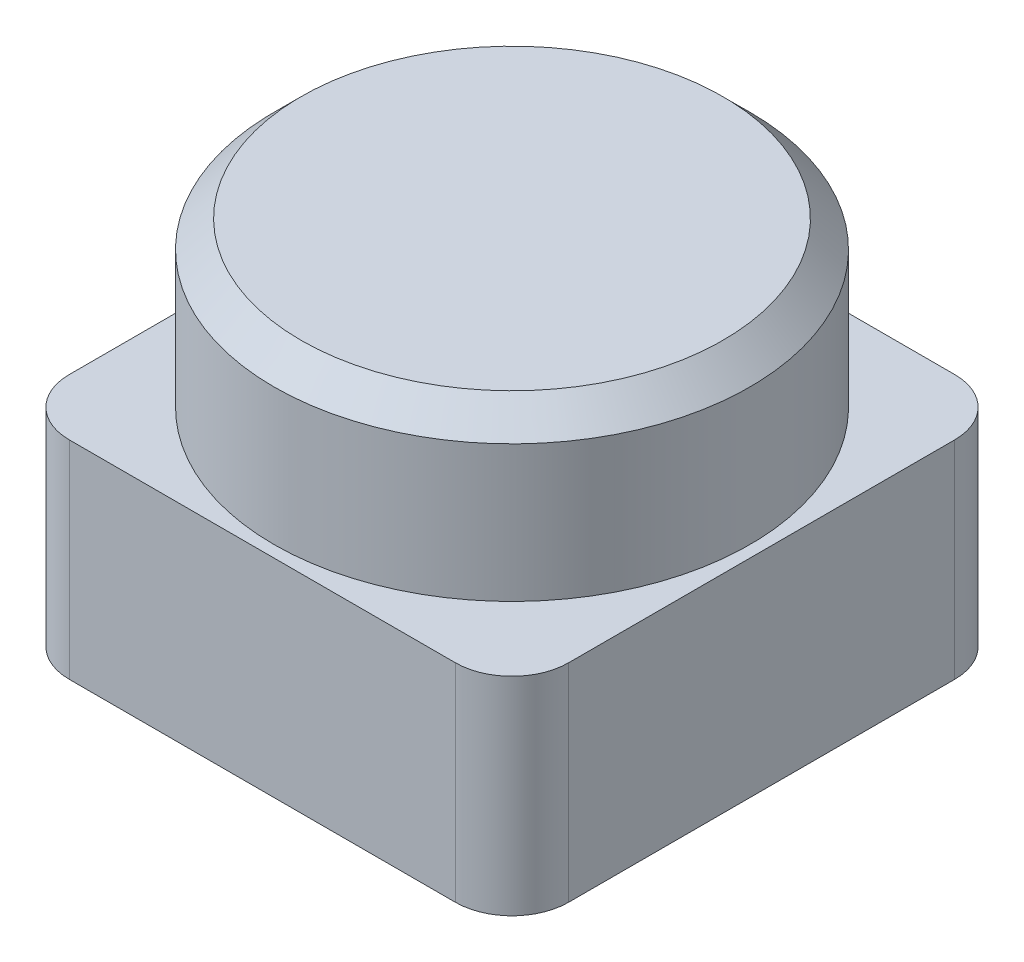
from build123d import *

# Parameters (mm, degrees)
SKETCH1_W           = 55.6
SKETCH1_H           = 55.6
BOSS_EXTRUDE1_DEPTH = 23.1
FILLET1_R           = 6.3
SKETCH2_R           = 1.25
SCREW_HOLES_DEPTH   = 4
SKETCH3_R           = 26.5
BOSS_EXTRUDE2_DEPTH = 18.2
CHAMFER1_SIZE       = 3


with BuildPart() as part:
    # Sketch1 → Boss-Extrude1 (new body)
    with BuildSketch(Plane(origin=(0, 0, 0), x_dir=(1, 0, 0), z_dir=(0, 1, 0))):
        with Locations((27.8, 27.8)):
            Rectangle(SKETCH1_W, SKETCH1_H)
    extrude(amount=BOSS_EXTRUDE1_DEPTH)

    # Fillet1
    fillet1_edges = [part.edges().sort_by_distance(p)[0] for p in [
        (0, 11.55, -55.6),
        (55.6, 11.55, -55.6),
        (55.6, 11.55, 0),
        (0, 11.55, 0),
    ]]
    fillet(fillet1_edges, radius=FILLET1_R)

    # Sketch2 → Screw Holes (cut)
    with BuildSketch(Plane.XZ):
        with Locations(Location((6.3, -6.3, 0), (0, 0, 270))):
            Circle(SKETCH2_R)
        with Locations(Location((49.3, -6.3, 0), (0, 0, 270))):
            Circle(SKETCH2_R)
        with Locations(Location((49.3, -49.3, 0), (0, 0, 270))):
            Circle(SKETCH2_R)
        with Locations(Location((6.3, -49.3, 0), (0, 0, 270))):
            Circle(SKETCH2_R)
    extrude(amount=-SCREW_HOLES_DEPTH, mode=Mode.SUBTRACT)

    # Sketch3 → Boss-Extrude2 (add)
    with BuildSketch(Plane(origin=(0, 23.1, 0), x_dir=(1, 0, 0), z_dir=(0, 1, 0))):
        with Locations(Location((27.8, 27.8, 0), (0, 0, 270))):
            Circle(SKETCH3_R)
    extrude(amount=BOSS_EXTRUDE2_DEPTH)

    # Chamfer1
    chamfer1_edges = [part.edges().sort_by_distance(p)[0] for p in [
        (27.8, 41.3, -54.3),
    ]]
    chamfer(chamfer1_edges, length=CHAMFER1_SIZE)


solid = part.part
